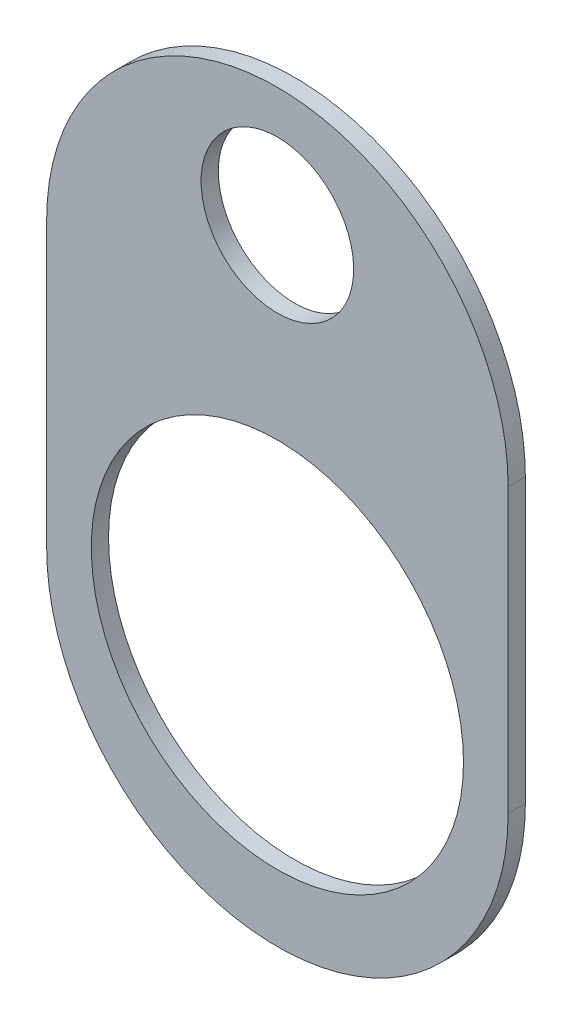
from build123d import *

# Parameters (mm, degrees)
FASTENER_BODY_DEPTH = 1.17602
CUT_EXTRUDE2_REACH  = 49.138
SKETCH3_R           = 5.207
SKETCH3_R_2         = 12.7


with BuildPart() as part:
    # Sketch2 → Fastener Body (new body)
    with BuildSketch(Plane.XY):
        with BuildLine():
            Line((0, 0), (0, 19.304))
            ThreePointArc((0, 19.304), (15.748, 35.052), (31.496, 19.304))
            Line((31.496, 19.304), (31.496, 0))
            ThreePointArc((31.496, 0), (15.748, -15.748), (0, 0))
        make_face()
    extrude(amount=-FASTENER_BODY_DEPTH)

    # Sketch3 → Cut-Extrude2 (cut, up to next)
    with BuildSketch(Plane.XY, mode=Mode.PRIVATE) as cut_extrude2_sk1:
        with Locations((15.748, 26.902177492)):
            Circle(SKETCH3_R)
    cut_extrude2_tool1 = extrude(cut_extrude2_sk1.sketch, amount=-CUT_EXTRUDE2_REACH, mode=Mode.PRIVATE) & part.part
    # Sketch3 → Cut-Extrude2 (cut, up to next)
    with BuildSketch(Plane.XY, mode=Mode.PRIVATE) as cut_extrude2_sk2:
        with Locations((15.748, 1.502177492)):
            Circle(SKETCH3_R_2)
    cut_extrude2_tool2 = extrude(cut_extrude2_sk2.sketch, amount=-CUT_EXTRUDE2_REACH, mode=Mode.PRIVATE) & part.part
    add(cut_extrude2_tool1.solids().sort_by_distance((15.748, 26.902177, 0))[0], mode=Mode.SUBTRACT)
    add(cut_extrude2_tool2.solids().sort_by_distance((15.748, 1.502177, 0))[0], mode=Mode.SUBTRACT)


solid = part.part
